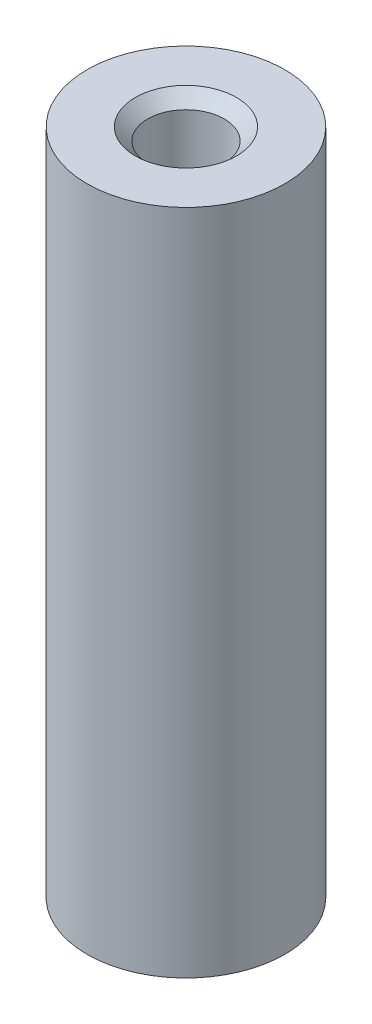
from build123d import *

# Parameters (mm, degrees)
SKIZZE1_R                        = 4
AUFSATZ_LINEAR_AUSTRAGEN1_DEPTH  = 27
F_3_1_3_1_DURCHMESSER_BOHRUNG1_D = 3.1
FASE1_SIZE                       = 0.5


with BuildPart() as part:
    # Skizze1 → Aufsatz-Linear austragen1 (new body)
    with BuildSketch(Plane(origin=(0, 0, 0), x_dir=(1, 0, 0), z_dir=(0, 1, 0))):
        with Locations(Location((0, 0, 0), (0, 0, 270))):
            Circle(SKIZZE1_R)
    extrude(amount=AUFSATZ_LINEAR_AUSTRAGEN1_DEPTH)

    # Ø3.1 (3.1) Durchmesser Bohrung1 (through all)
    with Locations(Plane(origin=(0, 27, 0), x_dir=(1, 0, 0), z_dir=(0, 1, 0))):
        with Locations((0, 0)):
            Hole(F_3_1_3_1_DURCHMESSER_BOHRUNG1_D / 2)

    # Fase1
    fase1_edges = [part.edges().sort_by_distance(p)[0] for p in [
        (1.55, 27, 0),
        (1.55, 0, 0),
    ]]
    chamfer(fase1_edges, length=FASE1_SIZE)


solid = part.part
